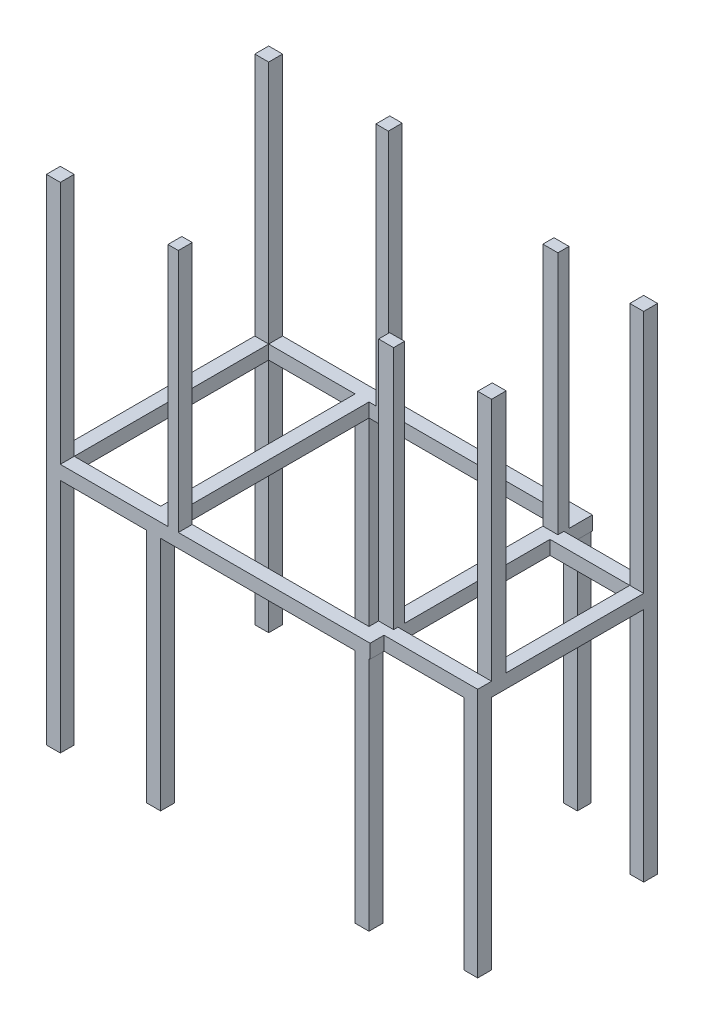
from build123d import *

# Parameters (mm, degrees)
CROQUIS1_W              = 700
CROQUIS1_H              = 700
CROQUIS1_W_2            = 287.203756055
CROQUIS1_H_2            = 547.555321307
CROQUIS1_W_3            = 311.038292855
SALIENTE_EXTRUIR1_DEPTH = 50
CROQUIS2_W              = 50
CROQUIS2_H              = 50
SALIENTE_EXTRUIR2_DEPTH = 850
CROQUIS3_W              = 50
CROQUIS3_H              = 50
CROQUIS3_H_2            = 52.444678691
CROQUIS3_W_2            = 44.735144292
CROQUIS3_W_3            = 37.538527074
CROQUIS3_W_4            = 54.044332967
CROQUIS3_H_3            = 39.518840668
CROQUIS3_W_5            = 54.044332968
CROQUIS3_H_4            = 39.951892275
SALIENTE_EXTRUIR3_DEPTH = 879.0597314
CROQUIS4_W              = 50
CROQUIS4_H              = 50
SALIENTE_EXTRUIR4_DEPTH = 850


with BuildPart() as part:
    # Croquis1 → Saliente-Extruir1 (new body)
    with BuildSketch(Plane(origin=(0, 0, 0), x_dir=(1, 0, 0), z_dir=(0, 1, 0))):
        Polygon((-45.955667033, -50), (754.044332967, -50), (754.044332967, 0), (1091.248089022, 0), (1091.248089022, 52.444678693), (1091.248089022, 647.555321307), (754.044332967, 647.555321307), (754.044332967, 750), (-45.955667033, 750), (-411.038292855, 750), (-411.038292855, -50), align=None)
        with Locations((350, 350)):
            Rectangle(CROQUIS1_W, CROQUIS1_H, mode=Mode.SUBTRACT)
        with Locations((897.646210995, 323.777660653)):
            Rectangle(CROQUIS1_W_2, CROQUIS1_H_2, mode=Mode.SUBTRACT)
        with Locations((-205.519146428, 350)):
            Rectangle(CROQUIS1_W_3, CROQUIS1_H, mode=Mode.SUBTRACT)
    extrude(amount=SALIENTE_EXTRUIR1_DEPTH)

    # Croquis2 → Saliente-Extruir2 (add)
    with BuildSketch(Plane.XZ):
        with Locations((-25, 25)):
            Rectangle(CROQUIS2_W, CROQUIS2_H)
        with Locations((725, 25)):
            Rectangle(CROQUIS2_W, CROQUIS2_H)
        with Locations((725, -725)):
            Rectangle(CROQUIS2_W, CROQUIS2_H)
        with Locations((-25, -725)):
            Rectangle(CROQUIS2_W, CROQUIS2_H)
    extrude(amount=SALIENTE_EXTRUIR2_DEPTH)

    # Croquis3 → Saliente-Extruir3 (add)
    with BuildSketch(Plane(origin=(0, 50, 0), x_dir=(1, 0, 0), z_dir=(0, 1, 0))):
        with Locations((-386.038292855, 725)):
            Rectangle(CROQUIS3_W, CROQUIS3_H)
        with Locations((1066.248089022, 622.555321307)):
            Rectangle(CROQUIS3_W, CROQUIS3_H)
        with Locations((1066.248089022, 76.222339346)):
            Rectangle(CROQUIS3_W, CROQUIS3_H_2)
        with Locations((-386.038292855, -25)):
            Rectangle(CROQUIS3_W, CROQUIS3_H)
        with Locations((47.209644204, 725)):
            Rectangle(CROQUIS3_W_2, CROQUIS3_H)
        with Locations((45.029305303, -25)):
            Rectangle(CROQUIS3_W_3, CROQUIS3_H)
        with Locations((727.022166484, 54.312727654)):
            Rectangle(CROQUIS3_W_4, CROQUIS3_H_3)
        with Locations((727.022166484, 645.903798151)):
            Rectangle(CROQUIS3_W_5, CROQUIS3_H_4)
    extrude(amount=SALIENTE_EXTRUIR3_DEPTH)

    # Croquis4 → Saliente-Extruir4 (add)
    with BuildSketch(Plane.XZ):
        with Locations((-386.038292855, 25)):
            Rectangle(CROQUIS4_W, CROQUIS4_H)
        with Locations((-386.038292855, -725)):
            Rectangle(CROQUIS4_W, CROQUIS4_H)
        with Locations((1066.248089022, -622.555321307)):
            Rectangle(CROQUIS4_W, CROQUIS4_H)
        with Locations((1066.248089022, -25)):
            Rectangle(CROQUIS4_W, CROQUIS4_H)
    extrude(amount=SALIENTE_EXTRUIR4_DEPTH)


solid = part.part
